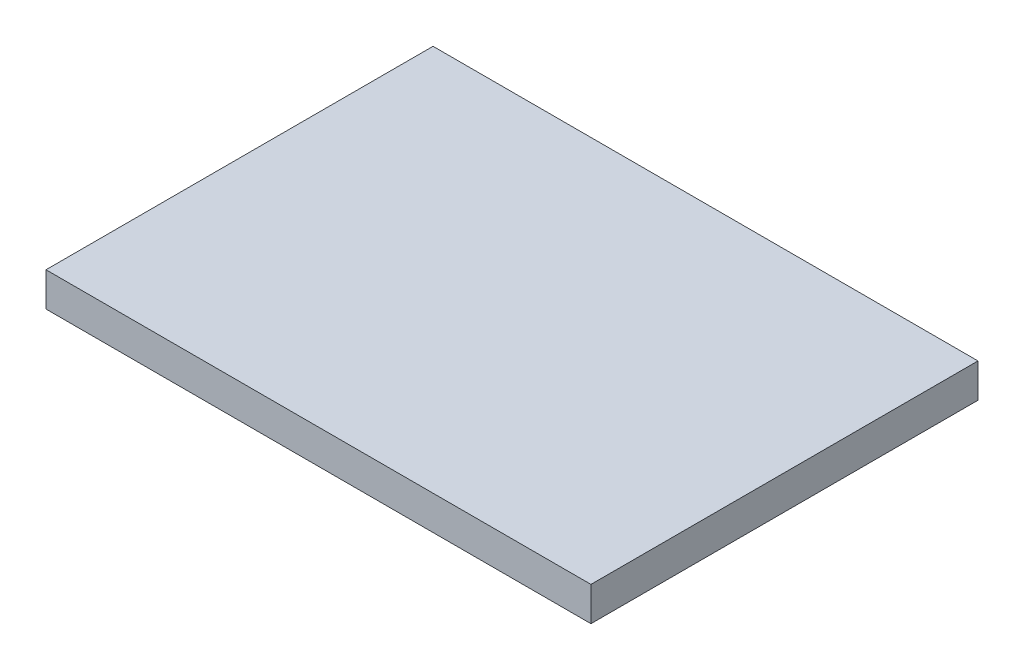
from build123d import *

# Parameters (mm, degrees)
SKETCH1_W           = 17.6
SKETCH1_H           = 12.5
BOSS_EXTRUDE1_DEPTH = 1.1


with BuildPart() as part:
    # Sketch1 → Boss-Extrude1 (new body)
    with BuildSketch(Plane(origin=(0, 0, 0), x_dir=(1, 0, 0), z_dir=(0, 1, 0))):
        Rectangle(SKETCH1_W, SKETCH1_H)
    extrude(amount=BOSS_EXTRUDE1_DEPTH)


solid = part.part
